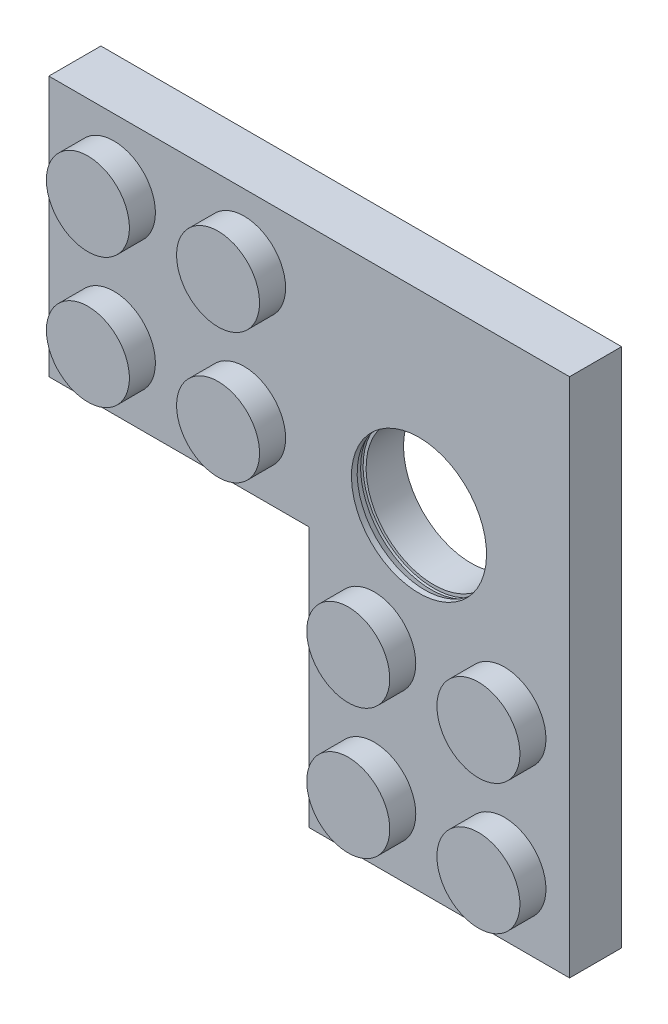
from build123d import *

# Parameters (mm, degrees)
SKETCH1_R           = 4.15
BOSS_EXTRUDE1_DEPTH = 3.2
CUT_EXTRUDE3_START  = 3.2
SKETCH1_3_R         = 2.55
CUT_EXTRUDE3_DEPTH  = 1.8
SKETCH1_4_R         = 2.55
BOSS_EXTRUDE2_DEPTH = 1.6


with BuildPart() as part:
    # Sketch1 → Boss-Extrude1 (new body)
    with BuildSketch(Plane(origin=(0, 0, -17.400004116), x_dir=(-1, 0, 0), z_dir=(0, 0, -1))):
        Polygon((2.501166814, -72.5), (-13.498833186, -72.5), (-13.498833186, -40.5), (18.501166814, -40.5), (18.501166814, -56.5), (2.501166814, -56.5), align=None)
        with Locations(Location((-4.246216621, -52.5, 0), (0, 0, 90))):
            Circle(SKETCH1_R, mode=Mode.SUBTRACT)
    extrude(amount=BOSS_EXTRUDE1_DEPTH)

    # Sketch1<3> → Cut-Extrude3 (cut)
    with BuildSketch(Plane(origin=(0, 0, -17.400004116), x_dir=(-1, 0, 0), z_dir=(0, 0, -1)).offset(CUT_EXTRUDE3_START)):
        with Locations(Location((6.501166814, -52.5, 0), (0, 0, 180))):
            Circle(SKETCH1_3_R)
        with Locations(Location((6.501166814, -44.5, 0), (0, 0, 180))):
            Circle(SKETCH1_3_R)
        with Locations(Location((14.501166814, -44.5, 0), (0, 0, 180))):
            Circle(SKETCH1_3_R)
        with Locations(Location((14.501166814, -52.5, 0), (0, 0, 180))):
            Circle(SKETCH1_3_R)
        with Locations(Location((-9.498833186, -60.5, 0), (0, 0, 180))):
            Circle(SKETCH1_3_R)
        with Locations(Location((-1.498833186, -60.5, 0), (0, 0, 180))):
            Circle(SKETCH1_3_R)
        with Locations(Location((-1.498833186, -68.5, 0), (0, 0, 180))):
            Circle(SKETCH1_3_R)
        with Locations(Location((-9.498833186, -68.5, 0), (0, 0, 180))):
            Circle(SKETCH1_3_R)
    extrude(amount=-CUT_EXTRUDE3_DEPTH, mode=Mode.SUBTRACT)

    # Sketch1<4> → Boss-Extrude2 (add)
    with BuildSketch(Plane(origin=(0, 0, -17.400004116), x_dir=(-1, 0, 0), z_dir=(0, 0, -1))):
        with Locations(Location((6.501166814, -44.5, 0), (0, 0, 180))):
            Circle(SKETCH1_4_R)
        with Locations(Location((14.501166814, -44.5, 0), (0, 0, 180))):
            Circle(SKETCH1_4_R)
        with Locations(Location((14.501166814, -52.5, 0), (0, 0, 180))):
            Circle(SKETCH1_4_R)
        with Locations(Location((6.501166814, -52.5, 0), (0, 0, 180))):
            Circle(SKETCH1_4_R)
        with Locations(Location((-1.498833186, -60.5, 0), (0, 0, 180))):
            Circle(SKETCH1_4_R)
        with Locations(Location((-1.498833186, -68.5, 0), (0, 0, 180))):
            Circle(SKETCH1_4_R)
        with Locations(Location((-9.498833186, -60.5, 0), (0, 0, 180))):
            Circle(SKETCH1_4_R)
        with Locations(Location((-9.498833186, -68.5, 0), (0, 0, 180))):
            Circle(SKETCH1_4_R)
    extrude(amount=-BOSS_EXTRUDE2_DEPTH)

    # Sketch2 → Cut-Revolve1 (revolve, cut)
    with BuildSketch(Plane(origin=(4.246216621, -52.5, -15.300004116), x_dir=(0, 0, 1), z_dir=(-1, 0, 0))):
        Polygon((-2.846789772, 4.335), (-1.913929092, 3.899999921), (-3, 3.900000008), (-3, 4.335), align=None)
    revolve(axis=Axis((4.246216621, -52.5, -17.665004136), (0, 0, 1)), mode=Mode.SUBTRACT)


solid = part.part
